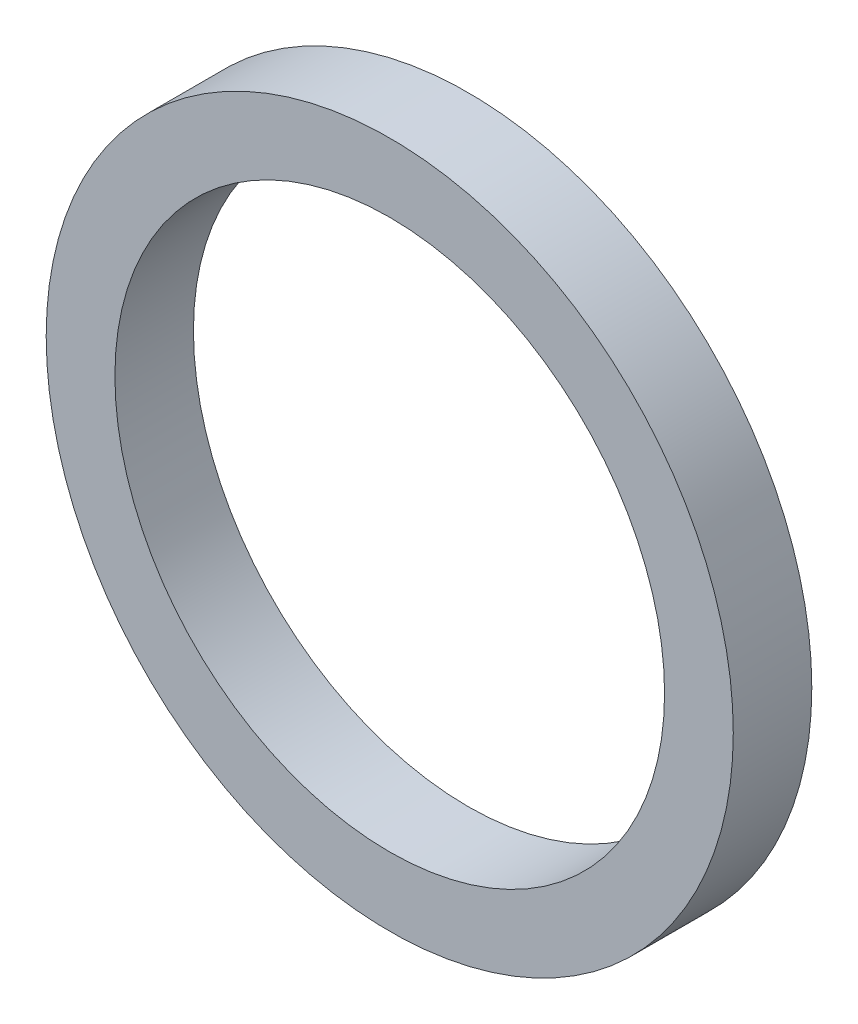
from build123d import *

# Parameters (mm, degrees)
SKETCH1_R           = 17.5
SKETCH1_R_2         = 14
BOSS_EXTRUDE1_DEPTH = 4


with BuildPart() as part:
    # Sketch1 → Boss-Extrude1 (new body)
    with BuildSketch(Plane(origin=(0, 0, 0), x_dir=(0, 1, 0), z_dir=(0, 0, 1))):
        with Locations(Location((0, 0, 0), (0, 0, 270))):
            Circle(SKETCH1_R)
        with Locations(Location((0, 0, 0), (0, 0, 270))):
            Circle(SKETCH1_R_2, mode=Mode.SUBTRACT)
    extrude(amount=BOSS_EXTRUDE1_DEPTH)


solid = part.part
